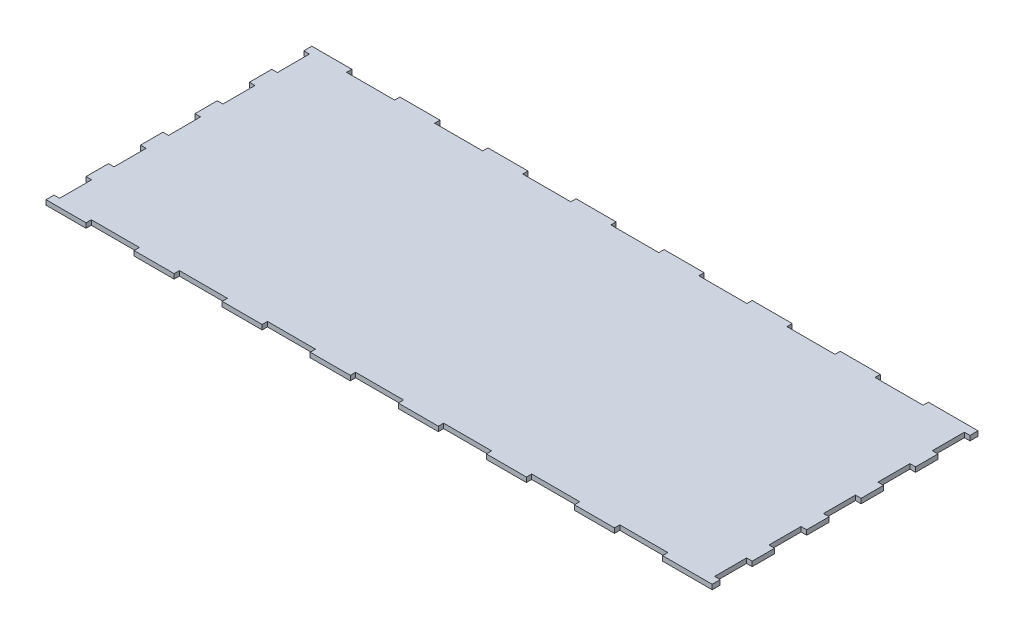
from build123d import *

# Parameters (mm, degrees)
SKETCH1_W           = 416
SKETCH1_H           = 166
BOSS_EXTRUDE1_DEPTH = 3
SKETCH2_W           = 30
SKETCH2_H           = 3.3
SKETCH2_W_2         = 3.5
SKETCH2_H_2         = 20
CUT_EXTRUDE1_DEPTH  = 3


with BuildPart() as part:
    # Sketch1 → Boss-Extrude1 (new body)
    with BuildSketch(Plane(origin=(0, 0, 0), x_dir=(1, 0, 0), z_dir=(0, 1, 0))):
        Rectangle(SKETCH1_W, SKETCH1_H)
    extrude(amount=BOSS_EXTRUDE1_DEPTH)

    # Sketch2 → Cut-Extrude1 (cut)
    with BuildSketch(Plane(origin=(0, 3, 0), x_dir=(1, 0, 0), z_dir=(0, 1, 0))):
        with Locations((-168, 81.35)):
            Rectangle(SKETCH2_W, SKETCH2_H)
        with Locations((-113, 81.35)):
            Rectangle(SKETCH2_W, SKETCH2_H)
        with Locations((-58, 81.35)):
            Rectangle(SKETCH2_W, SKETCH2_H)
        with Locations((-3, 81.35)):
            Rectangle(SKETCH2_W, SKETCH2_H)
        with Locations((52, 81.35)):
            Rectangle(SKETCH2_W, SKETCH2_H)
        with Locations((107, 81.35)):
            Rectangle(SKETCH2_W, SKETCH2_H)
        with Locations((162, 81.35)):
            Rectangle(SKETCH2_W, SKETCH2_H)
        with Locations((162, -81.35)):
            Rectangle(SKETCH2_W, SKETCH2_H)
        with Locations((107, -81.35)):
            Rectangle(SKETCH2_W, SKETCH2_H)
        with Locations((52, -81.35)):
            Rectangle(SKETCH2_W, SKETCH2_H)
        with Locations((-3, -81.35)):
            Rectangle(SKETCH2_W, SKETCH2_H)
        with Locations((-58, -81.35)):
            Rectangle(SKETCH2_W, SKETCH2_H)
        with Locations((-113, -81.35)):
            Rectangle(SKETCH2_W, SKETCH2_H)
        with Locations((-168, -81.35)):
            Rectangle(SKETCH2_W, SKETCH2_H)
        with Locations((-206.25, -34)):
            Rectangle(SKETCH2_W_2, SKETCH2_H_2)
        with Locations((-206.25, 0)):
            Rectangle(SKETCH2_W_2, SKETCH2_H_2)
        with Locations((-206.25, -68)):
            Rectangle(SKETCH2_W_2, SKETCH2_H_2)
        with Locations((-206.25, 34)):
            Rectangle(SKETCH2_W_2, SKETCH2_H_2)
        with Locations((-206.25, 68)):
            Rectangle(SKETCH2_W_2, SKETCH2_H_2)
        with Locations((206.25, -68)):
            Rectangle(SKETCH2_W_2, SKETCH2_H_2)
        with Locations((206.25, -34)):
            Rectangle(SKETCH2_W_2, SKETCH2_H_2)
        with Locations((206.25, 0)):
            Rectangle(SKETCH2_W_2, SKETCH2_H_2)
        with Locations((206.25, 34)):
            Rectangle(SKETCH2_W_2, SKETCH2_H_2)
        with Locations((206.25, 68)):
            Rectangle(SKETCH2_W_2, SKETCH2_H_2)
    extrude(amount=-CUT_EXTRUDE1_DEPTH, mode=Mode.SUBTRACT)


solid = part.part
